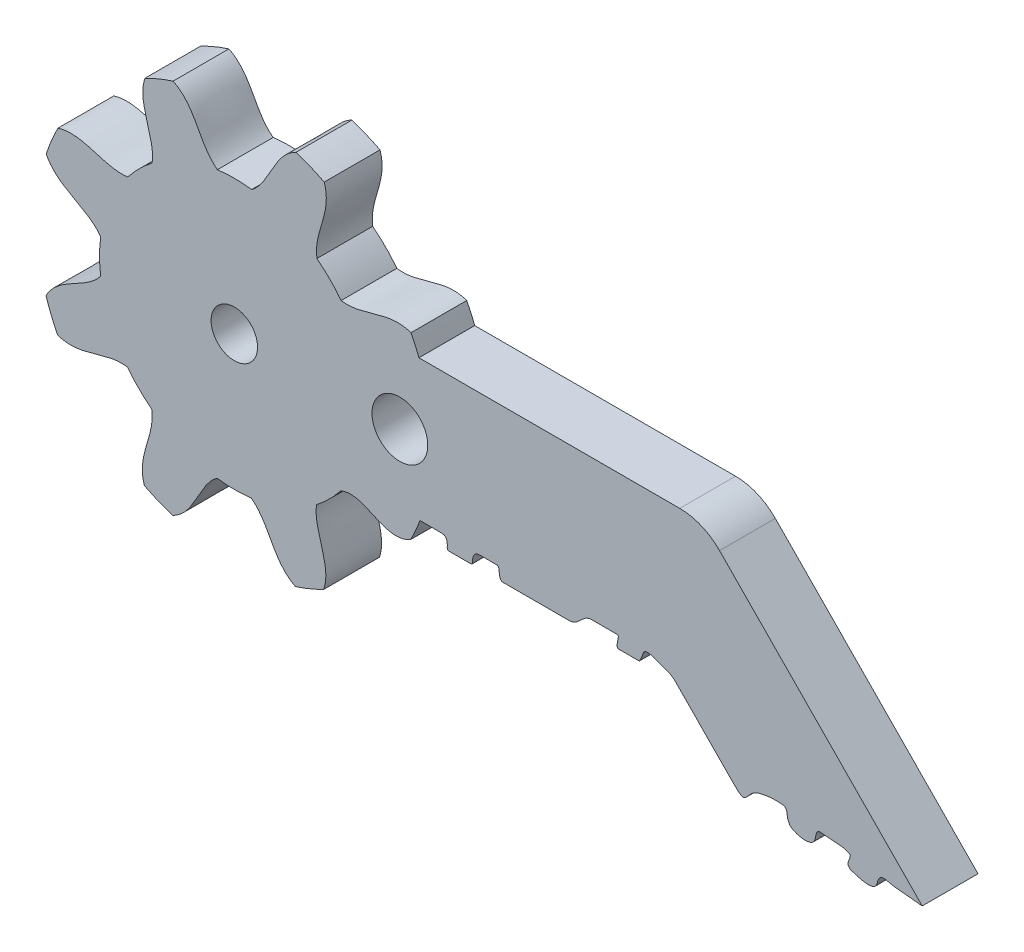
from build123d import *

# Parameters (mm, degrees)
ESQUISSE1_R             = 1.25
BOSS_EXTRU_1_DEPTH      = 3
CONG_1_R                = 3
ESQUISSE2_R             = 1.5
ENL_V_MAT_EXTRU_1_DEPTH = 10


with BuildPart() as part:
    # Esquisse1 → Boss.-Extru.1 (new body)
    with BuildSketch(Plane.XY):
        with BuildLine():
            Line((19.92975327, -6.3), (35.217971298, -6.3))
            Line((35.217971298, -6.3), (47, -18.3))
            Line((47, -18.3), (45.631202596, -18.164866086))
            add(Edge.make_bspline(
                [(44.574765673, -18.453081845), (44.609849099, -18.278093463), (44.810570852, -17.89677836), (45.205219796, -18.122811123), (45.631202596, -18.164866086)],
                knots=[0, 0, 0, 0, 0.363922375, 1, 1, 1, 1], degree=3))
            add(Edge.make_bspline(
                [(43.14719525, -18.550945105), (43.09751522, -18.50205817), (43.730894007, -18.788269797), (44.507224039, -18.789964599), (44.574765673, -18.453081845)],
                knots=[0, 0, 0, 0, 0.494582685, 1, 1, 1, 1], degree=3))
            add(Edge.make_bspline(
                [(43.078110836, -17.813160677), (43.233086748, -17.882249489), (42.868812221, -18.319185258), (43.087477408, -18.492180602), (43.14719525, -18.550945105)],
                knots=[0, 0, 0, 0, 0.680948688, 1, 1, 1, 1], degree=3))
            add(Edge.make_bspline(
                [(41.466586273, -17.601888285), (41.504069337, -17.589909306), (42.505756712, -17.693836279), (42.799520207, -17.688963985), (43.078110836, -17.813160677)],
                knots=[0, 0, 0, 0, 0.477700623, 1, 1, 1, 1], degree=3))
            add(Edge.make_bspline(
                [(39.844270523, -18.01177052), (39.904616243, -18.313831866), (41.426666849, -18.718352059), (41.243571394, -17.673160221), (41.466586273, -17.601888285)],
                knots=[0, 0, 0, 0, 0.705660207, 1, 1, 1, 1], degree=3))
            add(Edge.make_bspline(
                [(39.582059604, -17.342538581), (39.82174321, -17.521996239), (39.65531727, -17.763700919), (39.844270523, -18.01177052)],
                knots=[0, 0, 0, 0, 1, 1, 1, 1], degree=3))
            ThreePointArc((39.582059604, -17.342538581), (38.901892941, -17.323195475), (38.230573756, -17.434242297))
            add(Edge.make_bspline(
                [(36.784856269, -17.601888285), (37.210480557, -18.035386759), (37.505799664, -18.195146881), (37.795231884, -17.550105131), (38.230573756, -17.434242297)],
                knots=[0, 0, 0, 0, 0.460710551, 1, 1, 1, 1], degree=3))
            Line((36.784856269, -17.601888285), (33.731487311, -14.492031025))
            add(Edge.make_bspline(
                [(33.731487311, -14.492031025), (33.514450956, -14.270979429), (33.057221931, -14.130586993), (32.069360868, -13.726488082), (31.99227695, -14.033778698)],
                knots=[0, 0, 0, 0, 0.472738977, 1, 1, 1, 1], degree=3))
            ThreePointArc((31.99227695, -14.033778698), (31.907533679, -14.27645853), (31.780631614, -14.5))
            Line((31.780631614, -14.5), (30.678819449, -14.5))
            add(Edge.make_bspline(
                [(30.678819449, -14.5), (30.566879888, -14.5), (30.590912004, -14.184943581), (30.696767567, -13.852950327), (30.597609057, -13.852950327)],
                knots=[0, 0, 0, 0, 0.4739837, 1, 1, 1, 1], degree=3))
            Line((30.597609057, -13.852950327), (29.223744999, -13.852950327))
            add(Edge.make_bspline(
                [(29.223744999, -13.852950327), (28.69642769, -13.852950327), (28.543913483, -14.5), (28.011775663, -14.5)],
                knots=[0, 0, 0, 0, 1, 1, 1, 1], degree=3))
            Line((28.011775663, -14.5), (24.480450971, -14.5))
            add(Edge.make_bspline(
                [(24.480450971, -14.5), (24.119134276, -14.511094497), (24.35906075, -13.852950327), (24.113474847, -13.852950327)],
                knots=[0, 0, 0, 0, 0.869021917, 0.869021917, 0.869021917, 0.869021917], degree=3))
            Line((24.113474847, -13.852950327), (23.179553753, -13.852950327))
            add(Edge.make_bspline(
                [(23.179553753, -13.852950327), (22.992119455, -13.852950327), (22.770536848, -14.066530423), (22.823007832, -14.5), (22.744283986, -14.5)],
                knots=[0, 0, 0, 0, 0.61315008, 1, 1, 1, 1], degree=3))
            Line((22.744283986, -14.5), (21.51212894, -14.5))
            add(Edge.make_bspline(
                [(21.51212894, -14.5), (21.442415292, -14.5), (21.471474766, -14.175360412), (21.388427589, -13.83637058), (21.143014821, -13.852950327), (20.950444947, -13.852950327)],
                knots=[0, 0, 0, 0, 0.152029745, 0.482763063, 1, 1, 1, 1], degree=3))
            Line((20.950444947, -13.852950327), (19.985522464, -13.852950327))
            ThreePointArc((19.985522464, -13.852950327), (19.75349781, -14.426889112), (19.488517244, -14.986376796))
            add(Edge.make_bspline(
                [(19.488517244, -14.986376796), (18.093314004, -15.809671906), (17.029637143, -14.066327863), (15.730054573, -14.591731036)],
                knots=[0, 0, 0, 0, 1, 1, 1, 1], degree=3))
            ThreePointArc((15.730054573, -14.591731036), (15.118510747, -15.284525074), (14.42380974, -15.893901756))
            add(Edge.make_bspline(
                [(14.806712838, -19.653578889), (15.250545236, -18.321985455), (14.236323883, -17.180609482), (14.42380974, -15.893901756)],
                knots=[0, 0, 0, 0, 1, 1, 1, 1], degree=3))
            ThreePointArc((14.806712838, -19.653578889), (14.060205467, -19.995670702), (13.289560057, -20.279229716))
            add(Edge.make_bspline(
                [(13.289560057, -20.279229716), (12.036111486, -19.647569245), (11.950961464, -18.123058328), (10.910982309, -17.342538581)],
                knots=[0, 0, 0, 0, 1, 1, 1, 1], degree=3))
            ThreePointArc((10.910982309, -17.342538581), (9.988676161, -17.399991157), (9.066553984, -17.339657748))
            add(Edge.make_bspline(
                [(6.678814165, -20.268904321), (7.93422981, -19.641162472), (8.024141705, -18.116924986), (9.066553984, -17.339657748)],
                knots=[0, 0, 0, 0, 1, 1, 1, 1], degree=3))
            ThreePointArc((6.678814165, -20.268904321), (5.909058301, -19.982939337), (5.163623204, -19.638517244))
            add(Edge.make_bspline(
                [(5.163623204, -19.638517244), (4.723952621, -18.305543857), (5.74173447, -17.167341691), (5.558268964, -15.880054573)],
                knots=[0, 0, 0, 0, 1, 1, 1, 1], degree=3))
            ThreePointArc((5.558268964, -15.880054573), (4.865474926, -15.268510747), (4.256098244, -14.573809741))
            add(Edge.make_bspline(
                [(0.496421111, -14.956712838), (1.828014545, -15.400545236), (2.969390518, -14.386323883), (4.256098244, -14.573809741)],
                knots=[0, 0, 0, 0, 1, 1, 1, 1], degree=3))
            ThreePointArc((0.496421111, -14.956712838), (0.154329299, -14.210205467), (-0.129229715, -13.439560057))
            add(Edge.make_bspline(
                [(-0.129229715, -13.439560057), (0.502430755, -12.186111486), (2.026941672, -12.100961464), (2.807461419, -11.060982309)],
                knots=[0, 0, 0, 0, 1, 1, 1, 1], degree=3))
            ThreePointArc((2.807461419, -11.060982309), (2.750008843, -10.138676161), (2.810342252, -9.216553984))
            add(Edge.make_bspline(
                [(-0.118904321, -6.828814165), (0.508837528, -8.08422981), (2.033075015, -8.174141705), (2.810342252, -9.216553984)],
                knots=[0, 0, 0, 0, 1, 1, 1, 1], degree=3))
            ThreePointArc((-0.118904321, -6.828814165), (0.167060663, -6.059058301), (0.511482756, -5.313623204))
            add(Edge.make_bspline(
                [(0.511482756, -5.313623204), (1.844456143, -4.873952621), (2.982658309, -5.89173447), (4.269945427, -5.708268964)],
                knots=[0, 0, 0, 0, 1, 1, 1, 1], degree=3))
            ThreePointArc((4.269945427, -5.708268964), (4.881489253, -5.015474926), (5.57619026, -4.406098244))
            add(Edge.make_bspline(
                [(5.193287162, -0.646421111), (4.749454764, -1.978014545), (5.763676116, -3.119390518), (5.57619026, -4.406098244)],
                knots=[0, 0, 0, 0, 1, 1, 1, 1], degree=3))
            ThreePointArc((5.193287162, -0.646421111), (5.939794533, -0.304329298), (6.710439943, -0.020770284))
            add(Edge.make_bspline(
                [(6.710439943, -0.020770284), (7.963888514, -0.652430755), (8.049038536, -2.176941672), (9.089017691, -2.957461419)],
                knots=[0, 0, 0, 0, 1, 1, 1, 1], degree=3))
            ThreePointArc((9.089017691, -2.957461419), (10.011323839, -2.900008843), (10.933446016, -2.960342252))
            add(Edge.make_bspline(
                [(13.321185835, -0.031095679), (12.06577019, -0.658837528), (11.975858295, -2.183075014), (10.933446016, -2.960342252)],
                knots=[0, 0, 0, 0, 1, 1, 1, 1], degree=3))
            ThreePointArc((13.321185835, -0.031095679), (14.0909417, -0.317060663), (14.836376797, -0.661482756))
            add(Edge.make_bspline(
                [(14.836376797, -0.661482756), (15.276047379, -1.994456143), (14.25826553, -3.132658309), (14.441731036, -4.419945428)],
                knots=[0, 0, 0, 0, 1, 1, 1, 1], degree=3))
            ThreePointArc((14.441731036, -4.419945428), (15.134525074, -5.031489253), (15.743901756, -5.72619026))
            add(Edge.make_bspline(
                [(19.503578889, -5.343287162), (18.171985455, -4.899454764), (17.030609482, -5.913676116), (15.743901756, -5.72619026)],
                knots=[0, 0, 0, 0, 1, 1, 1, 1], degree=3))
            ThreePointArc((19.503578889, -5.343287162), (19.728433818, -5.81640156), (19.92975327, -6.3))
        make_face()
        with Locations((10, -10.15)):
            Circle(ESQUISSE1_R, mode=Mode.SUBTRACT)
    extrude(amount=BOSS_EXTRU_1_DEPTH)

    # Congé1
    cong_1_edges = [part.edges().sort_by_distance(p)[0] for p in [
        (35.217971298, -6.3, 1.5),
    ]]
    fillet(cong_1_edges, radius=CONG_1_R)

    # Esquisse2 → Enlèv. mat.-Extru.1 (cut)
    with BuildSketch(Plane(origin=(0, 0, 0), x_dir=(-1, 0, 0), z_dir=(0, 0, -1))):
        with Locations((-18.904357786, -10.141593779)):
            Circle(ESQUISSE2_R)
    extrude(amount=-ENL_V_MAT_EXTRU_1_DEPTH, mode=Mode.SUBTRACT)


solid = part.part
